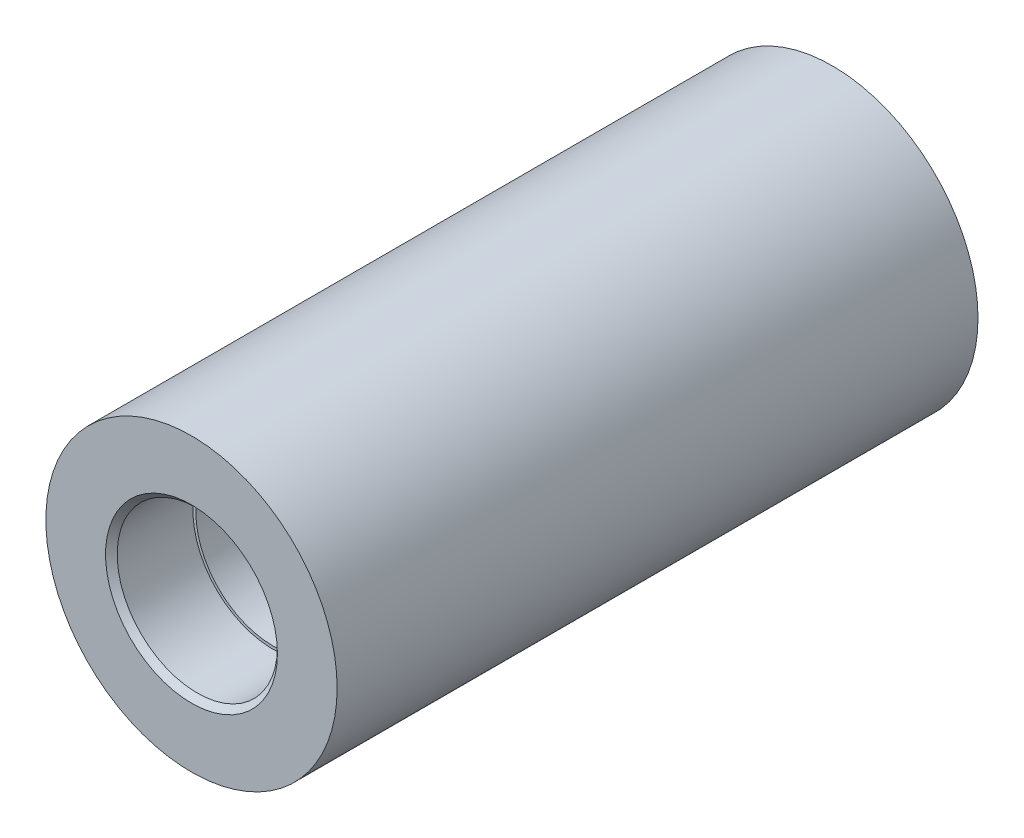
from build123d import *

# Parameters (mm, degrees)
SKIZZE1_R                       = 10
SKIZZE1_R_2                     = 5.3
AUFSATZ_LINEAR_AUSTRAGEN1_DEPTH = 44
SKIZZE2_R                       = 5.5
SCHNITT_LINEAR_AUSTRAGEN1_DEPTH = 5.6
SKIZZE3_R                       = 5.894998856
SCHNITT_LINEAR_AUSTRAGEN2_DEPTH = 5.6
FASE1_SIZE                      = 0.4


with BuildPart() as part:
    # Skizze1 → Aufsatz-Linear austragen1 (new body)
    with BuildSketch(Plane.XY):
        Circle(SKIZZE1_R)
        Circle(SKIZZE1_R_2, mode=Mode.SUBTRACT)
    extrude(amount=AUFSATZ_LINEAR_AUSTRAGEN1_DEPTH)

    # Skizze2 → Schnitt-Linear austragen1 (cut)
    with BuildSketch(Plane.XY.offset(44)):
        Circle(SKIZZE2_R)
    extrude(amount=-SCHNITT_LINEAR_AUSTRAGEN1_DEPTH, mode=Mode.SUBTRACT)

    # Skizze3 → Schnitt-Linear austragen2 (cut)
    with BuildSketch(Plane(origin=(0, 0, 0), x_dir=(-1, 0, 0), z_dir=(0, 0, -1))):
        Circle(SKIZZE3_R)
    extrude(amount=-SCHNITT_LINEAR_AUSTRAGEN2_DEPTH, mode=Mode.SUBTRACT)

    # Fase1
    fase1_edges = [part.edges().sort_by_distance(p)[0] for p in [
        (-5.5, 0, 44),
        (5.894998856, 0, 0),
    ]]
    chamfer(fase1_edges, length=FASE1_SIZE)


solid = part.part
